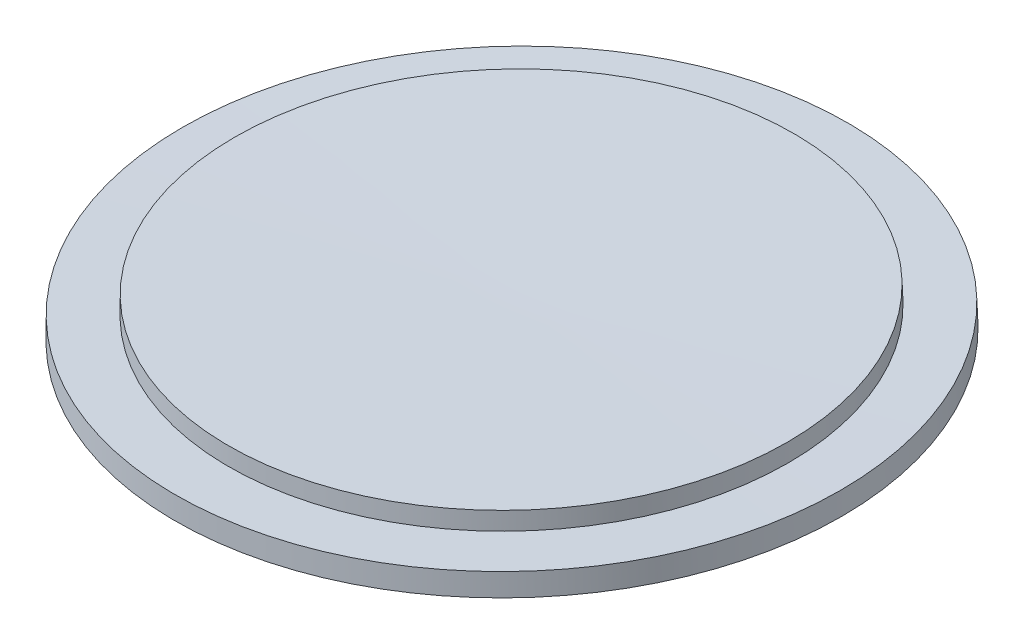
from build123d import *

# Parameters (mm, degrees)
SCALE1_SCALE = 0.1


with BuildPart() as part:
    # Sketch1 → Revolve1 (revolve)
    with BuildSketch(Plane.XY, mode=Mode.PRIVATE) as revolve1_sk:
        Polygon((71.416114258, 0), (6084.572475095, 0), (6075.548295604, 405.64985283), (1024.046894476, 405.64985283), (71.416114258, 405.64985283), align=None)
        Polygon((1024.046894476, 405.64985283), (6075.548295604, 405.64985283), (6068.399037919, 727.019272662), (1024.046894476, 727.019272662), align=None)
    revolve(revolve1_sk.sketch.rotate(Axis((6084.572475095, 0, 0), (-0.022240726201759216, 0.9997526444566268, 0)), 180), axis=Axis((6084.572475095, 0, 0), (-0.022240726201759216, 0.9997526444566268, 0)))


with BuildPart() as part_1:
    # Scale1: scaled about (0, 0, 0)
    add(part.part.scale(SCALE1_SCALE))


solid = part_1.part
